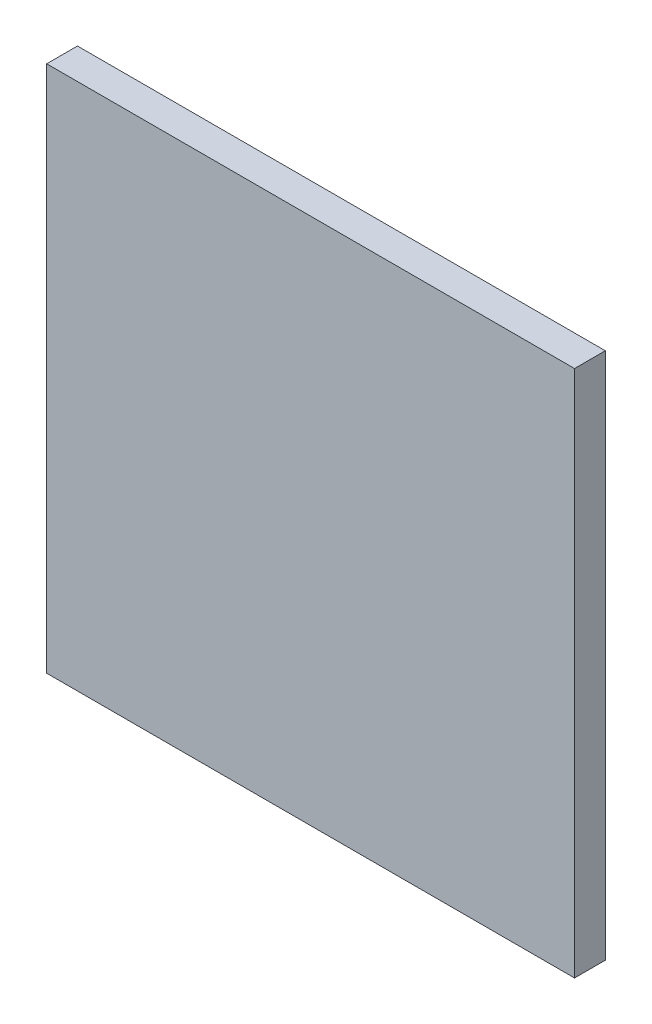
from build123d import *

# Parameters (mm, degrees)
SKETCH1_W           = 95.25
SKETCH1_H           = 95.25
BOSS_EXTRUDE1_DEPTH = 5.55625


with BuildPart() as part:
    # Sketch1 → Boss-Extrude1 (new body)
    with BuildSketch(Plane.XY):
        Rectangle(SKETCH1_W, SKETCH1_H)
    extrude(amount=BOSS_EXTRUDE1_DEPTH)


solid = part.part
